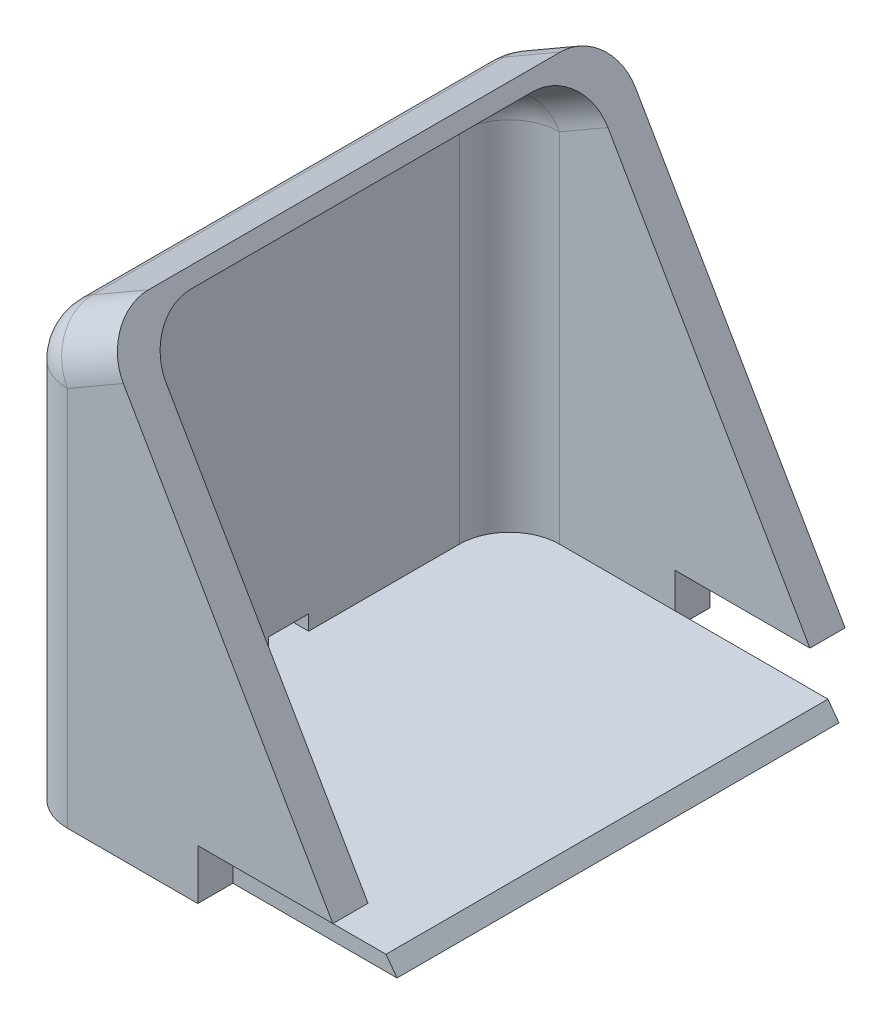
from build123d import *

# Parameters (mm, degrees)
AUFSATZ_LINEAR_AUSTRAGEN1_DEPTH = 7
SKIZZE2_W                       = 35.92542340335845
SKIZZE2_H                       = 3
AUFSATZ_LINEAR_AUSTRAGEN2_DEPTH = 44
SKIZZE4_W                       = 35.92542340335845
SKIZZE4_H                       = 3
AUFSATZ_LINEAR_AUSTRAGEN3_DEPTH = 7
SKIZZE6_W                       = 88
SKIZZE6_H                       = 3
AUFSATZ_LINEAR_AUSTRAGEN4_DEPTH = 32.68
AUFSATZ_LINEAR_AUSTRAGEN5_DEPTH = 88
SKIZZE8_W                       = 8
SKIZZE8_H                       = 3.0000000000000004
SCHNITT_LINEAR_AUSTRAGEN1_DEPTH = 3
VERRUNDUNG1_R                   = 10
VERRUNDUNG2_R                   = 10
SCHNITT_LINEAR_AUSTRAGEN2_DEPTH = 137.3244146724952


with BuildPart() as part:
    # Skizze1 → Aufsatz-Linear austragen1 (new body)
    with BuildSketch(Plane.XY):
        Polygon((-35.925423403358465, 81.63419686002398), (-19.820381056767047, 90.93244739413896), (26.90598923241485, 10.000000000000005), (0, 10.000000000000002), (0, 0), (-35.92542340335845, -4.4e-15), align=None)
    extrude(amount=AUFSATZ_LINEAR_AUSTRAGEN1_DEPTH)

    # Skizze2 → Aufsatz-Linear austragen2 (add)
    with BuildSketch(Plane(origin=(0, 0, 0), x_dir=(-1, 0, 0), z_dir=(0, 0, -1))):
        with Locations((17.962711701679225, 1.5)):
            Rectangle(SKIZZE2_W, SKIZZE2_H)
    aufsatz_linear_austragen2 = extrude(amount=AUFSATZ_LINEAR_AUSTRAGEN2_DEPTH)

    # Spiegeln3: Aufsatz-Linear austragen2 across plane
    add(aufsatz_linear_austragen2.mirror(Plane(origin=(0, 0, -44), x_dir=(1, 0, 0), z_dir=(0, 0, -1))))

    # Skizze4 → Aufsatz-Linear austragen3 (add)
    with BuildSketch(Plane(origin=(0, 0, -88), x_dir=(-1, 0, 0), z_dir=(0, 0, -1))):
        Polygon((-26.905989232414854, 10.000000000000005), (0, 10.000000000000002), (0, 3), (35.92542340335845, 3), (35.925423403358465, 81.63419686002398), (19.820381056767047, 90.93244739413895), align=None)
        with Locations((17.962711701679225, 1.5)):
            Rectangle(SKIZZE4_W, SKIZZE4_H)
    extrude(amount=AUFSATZ_LINEAR_AUSTRAGEN3_DEPTH)

    # Skizze6 → Aufsatz-Linear austragen4 (add)
    with BuildSketch(Plane(origin=(0, 0, 0), x_dir=(0, 0, -1), z_dir=(1, 0, 0))):
        with Locations((44, 1.5)):
            Rectangle(SKIZZE6_W, SKIZZE6_H)
    extrude(amount=AUFSATZ_LINEAR_AUSTRAGEN4_DEPTH)

    # Skizze7 → Aufsatz-Linear austragen5 (add)
    with BuildSketch(Plane.XY.offset(-88)):
        Polygon((-35.92542340335845, 3), (-32.92542340335845, 3), (-32.92542340335845, 79.9021460524551), (-35.925423403358465, 78.17009524488621), align=None)
        Polygon((-35.925423403358465, 78.17009524488621), (-32.92542340335845, 79.9021460524551), (-32.92542340335845, 83.36624766759286), (-35.925423403358465, 81.63419686002398), align=None)
        Polygon((-32.92542340335845, 83.36624766759286), (-32.92542340335845, 79.9021460524551), (-18.32038105676701, 88.33437118278556), (-19.82038105676704, 90.93244739413895), align=None)
    extrude(amount=AUFSATZ_LINEAR_AUSTRAGEN5_DEPTH)

    # Skizze8 → Schnitt-Linear austragen1 (cut)
    with BuildSketch(Plane.ZY.offset(35.92542340335845)):
        with Locations((-43.99999999999999, 4.500000000000002)):
            Rectangle(SKIZZE8_W, SKIZZE8_H)
    extrude(amount=-SCHNITT_LINEAR_AUSTRAGEN1_DEPTH, mode=Mode.SUBTRACT)

    # Verrundung1
    verrundung1_edges = [part.edges().sort_by_distance(p)[0] for p in [
        (-35.92542340335846, 40.81709843001198, 7),
        (-35.925423403358465, 81.63419686002398, -44),
        (-27.872902230062756, 86.28332212708148, 7),
        (-35.92542340335846, 40.81709843001199, -95),
        (-27.872902230062756, 86.28332212708146, -95),
    ]]
    fillet(verrundung1_edges, radius=VERRUNDUNG1_R)

    # Verrundung2
    verrundung2_edges = [part.edges().sort_by_distance(p)[0] for p in [
        (-32.92542340335845, 41.45107302622755, -88),
        (-32.92542340335845, 79.9021460524551, -44),
        (-25.622902230062728, 84.11825861762033, -88),
        (-32.92542340335845, 41.45107302622755, 0),
        (-25.622902230062728, 84.11825861762033, 0),
    ]]
    fillet(verrundung2_edges, radius=VERRUNDUNG2_R)

    # Skizze9 → Schnitt-Linear austragen2 (cut, through all)
    with BuildSketch(Plane.XY):
        Polygon((32.68, 0), (30.488543123002803, 3), (32.68, 3), align=None)
    extrude(amount=-SCHNITT_LINEAR_AUSTRAGEN2_DEPTH, mode=Mode.SUBTRACT)


solid = part.part
